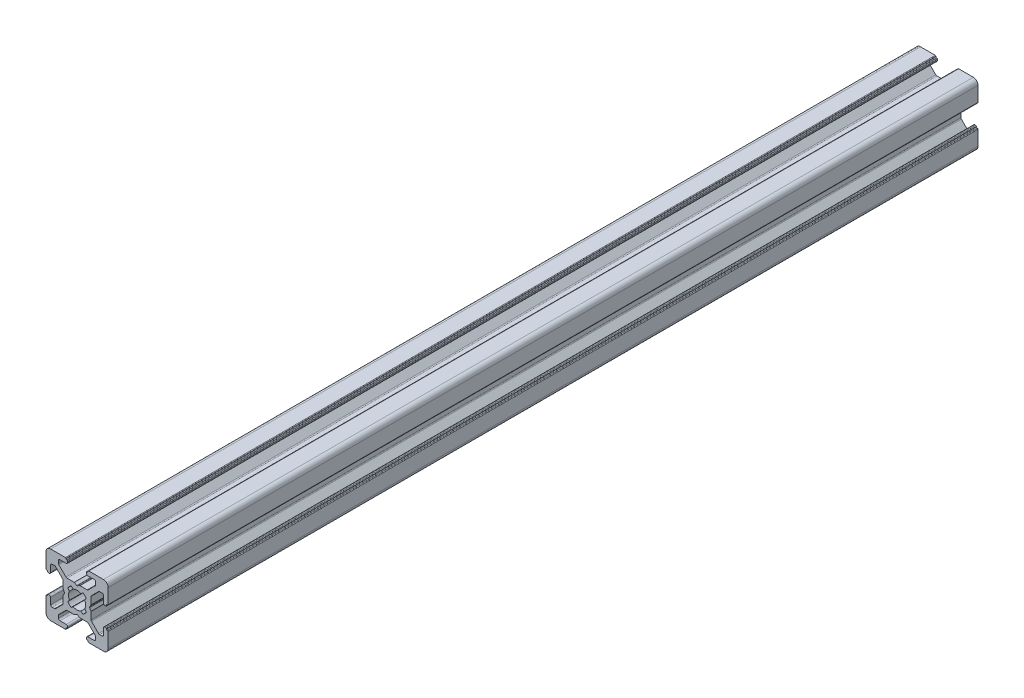
from build123d import *

# Parameters (mm, degrees)
EXTRUDE1_DEPTH = 280


with BuildPart() as part:
    # Sketch1 → Extrude1 (new body)
    with BuildSketch(Plane.XY):
        with BuildLine():
            Line((-3.5, 8.499999673), (-5.500000686, 8.499999673))
            ThreePointArc((-5.500000686, 8.499999673), (-5.853554077, 8.353553064), (-6.000000686, 7.999999673))
            Line((-6.000000686, 7.999999673), (-6.000000686, 7.267766626))
            ThreePointArc((-6.000000686, 7.267766626), (-5.961940448, 7.076424899), (-5.853554059, 6.914213219))
            Line((-5.853554059, 6.914213219), (-3.585787212, 4.646446592))
            ThreePointArc((-3.585787212, 4.646446592), (-3.423575544, 4.538060229), (-3.232233839, 4.5))
            Line((-3.232233839, 4.5), (-0.953590312, 4.5))
            ThreePointArc((-0.953590312, 4.5), (-0.901826505, 4.493185166), (-0.853590316, 4.473205083))
            Line((-0.853590316, 4.473205083), (-0.100000045, 4.038119562))
            ThreePointArc((-0.100000045, 4.038119562), (0, 4.011324632), (0.100000045, 4.038119562))
            Line((0.100000045, 4.038119562), (0.853590316, 4.473205083))
            ThreePointArc((0.853590316, 4.473205083), (0.901826505, 4.493185166), (0.953590312, 4.5))
            Line((0.953590312, 4.5), (3.232233839, 4.5))
            ThreePointArc((3.232233839, 4.5), (3.423575544, 4.538060229), (3.585787212, 4.646446592))
            Line((3.585787212, 4.646446592), (5.853554059, 6.914213219))
            ThreePointArc((5.853554059, 6.914213219), (5.961940448, 7.076424899), (6.000000686, 7.267766626))
            Line((6.000000686, 7.267766626), (6.000000686, 7.999999673))
            ThreePointArc((6.000000686, 7.999999673), (5.853554077, 8.353553064), (5.500000686, 8.499999673))
            Line((5.500000686, 8.499999673), (3.5, 8.499999673))
            ThreePointArc((3.5, 8.499999673), (3.146446609, 8.646446283), (3, 8.999999673))
            Line((3, 8.999999673), (3, 9.3))
            ThreePointArc((3, 9.3), (3.058578644, 9.441421356), (3.2, 9.5))
            Line((3.2, 9.5), (3.350000228, 9.5))
            ThreePointArc((3.350000228, 9.5), (3.491421584, 9.558578644), (3.550000228, 9.7))
            Line((3.550000228, 9.7), (3.550000228, 9.8))
            ThreePointArc((3.550000228, 9.8), (3.608578871, 9.941421356), (3.750000228, 10))
            Line((3.750000228, 10), (8.5, 10))
            ThreePointArc((8.5, 10), (9.560660172, 9.560660172), (10, 8.5))
            Line((10, 8.5), (10, 3.749999605))
            ThreePointArc((10, 3.749999605), (9.941421356, 3.608578248), (9.8, 3.549999605))
            Line((9.8, 3.549999605), (9.699999732, 3.549999605))
            ThreePointArc((9.699999732, 3.549999605), (9.558578376, 3.491420961), (9.499999732, 3.349999605))
            Line((9.499999732, 3.349999605), (9.499999732, 3.2))
            ThreePointArc((9.499999732, 3.2), (9.441421088, 3.058578644), (9.299999732, 3))
            Line((9.299999732, 3), (8.999999732, 3))
            ThreePointArc((8.999999732, 3), (8.646446341, 3.146446609), (8.499999732, 3.5))
            Line((8.499999732, 3.5), (8.499999732, 5.499999605))
            ThreePointArc((8.499999732, 5.499999605), (8.353553123, 5.853552995), (7.999999732, 5.999999605))
            Line((7.999999732, 5.999999605), (7.267766685, 5.999999605))
            ThreePointArc((7.267766685, 5.999999605), (7.076424969, 5.961939371), (6.914213294, 5.853552995))
            Line((6.914213294, 5.853552995), (4.646446398, 3.585786099))
            ThreePointArc((4.646446398, 3.585786099), (4.538060023, 3.423574425), (4.499999789, 3.232232708))
            Line((4.499999789, 3.232232708), (4.499999789, 0.953589302))
            ThreePointArc((4.499999789, 0.953589302), (4.493184953, 0.90182549), (4.473204867, 0.853589297))
            Line((4.473204867, 0.853589297), (4.038119841, 0.099999969))
            ThreePointArc((4.038119841, 0.099999969), (4.011324929, 0), (4.038119841, -0.099999969))
            Line((4.038119841, -0.099999969), (4.473204867, -0.853589297))
            ThreePointArc((4.473204867, -0.853589297), (4.493184953, -0.90182549), (4.499999789, -0.953589302))
            Line((4.499999789, -0.953589302), (4.499999789, -3.232232708))
            ThreePointArc((4.499999789, -3.232232708), (4.538060023, -3.423574425), (4.646446398, -3.585786099))
            Line((4.646446398, -3.585786099), (6.914213294, -5.853552995))
            ThreePointArc((6.914213294, -5.853552995), (7.076424969, -5.961939371), (7.267766685, -5.999999605))
            Line((7.267766685, -5.999999605), (7.999999732, -5.999999605))
            ThreePointArc((7.999999732, -5.999999605), (8.353553123, -5.853552995), (8.499999732, -5.499999605))
            Line((8.499999732, -5.499999605), (8.499999732, -3.5))
            ThreePointArc((8.499999732, -3.5), (8.646446341, -3.146446609), (8.999999732, -3))
            Line((8.999999732, -3), (9.299999732, -3))
            ThreePointArc((9.299999732, -3), (9.441421088, -3.058578644), (9.499999732, -3.2))
            Line((9.499999732, -3.2), (9.499999732, -3.349999605))
            ThreePointArc((9.499999732, -3.349999605), (9.558578376, -3.491420961), (9.699999732, -3.549999605))
            Line((9.699999732, -3.549999605), (9.8, -3.549999605))
            ThreePointArc((9.8, -3.549999605), (9.941421356, -3.608578248), (10, -3.749999605))
            Line((10, -3.749999605), (10, -8.5))
            ThreePointArc((10, -8.5), (9.560660172, -9.560660172), (8.5, -10))
            Line((8.5, -10), (3.750000228, -10))
            ThreePointArc((3.750000228, -10), (3.608578871, -9.941421356), (3.550000228, -9.8))
            Line((3.550000228, -9.8), (3.550000228, -9.7))
            ThreePointArc((3.550000228, -9.7), (3.491421584, -9.558578644), (3.350000228, -9.5))
            Line((3.350000228, -9.5), (3.2, -9.5))
            ThreePointArc((3.2, -9.5), (3.058578644, -9.441421356), (3, -9.3))
            Line((3, -9.3), (3, -8.999999673))
            ThreePointArc((3, -8.999999673), (3.146446609, -8.646446283), (3.5, -8.499999673))
            Line((3.5, -8.499999673), (5.500000686, -8.499999673))
            ThreePointArc((5.500000686, -8.499999673), (5.853554077, -8.353553064), (6.000000686, -7.999999673))
            Line((6.000000686, -7.999999673), (6.000000686, -7.267766626))
            ThreePointArc((6.000000686, -7.267766626), (5.961940448, -7.076424899), (5.853554059, -6.914213219))
            Line((5.853554059, -6.914213219), (3.585787212, -4.646446592))
            ThreePointArc((3.585787212, -4.646446592), (3.423575544, -4.538060229), (3.232233839, -4.5))
            Line((3.232233839, -4.5), (0.953590312, -4.5))
            ThreePointArc((0.953590312, -4.5), (0.901826505, -4.493185166), (0.853590316, -4.473205083))
            Line((0.853590316, -4.473205083), (0.100000045, -4.038119562))
            ThreePointArc((0.100000045, -4.038119562), (0, -4.011324632), (-0.100000045, -4.038119562))
            Line((-0.100000045, -4.038119562), (-0.853590316, -4.473205083))
            ThreePointArc((-0.853590316, -4.473205083), (-0.901826505, -4.493185166), (-0.953590312, -4.5))
            Line((-0.953590312, -4.5), (-3.232233839, -4.5))
            ThreePointArc((-3.232233839, -4.5), (-3.423575544, -4.538060229), (-3.585787212, -4.646446592))
            Line((-3.585787212, -4.646446592), (-5.853554059, -6.914213219))
            ThreePointArc((-5.853554059, -6.914213219), (-5.961940448, -7.076424899), (-6.000000686, -7.267766626))
            Line((-6.000000686, -7.267766626), (-6.000000686, -7.999999673))
            ThreePointArc((-6.000000686, -7.999999673), (-5.853554077, -8.353553064), (-5.500000686, -8.499999673))
            Line((-5.500000686, -8.499999673), (-3.5, -8.499999673))
            ThreePointArc((-3.5, -8.499999673), (-3.146446609, -8.646446283), (-3, -8.999999673))
            Line((-3, -8.999999673), (-3, -9.3))
            ThreePointArc((-3, -9.3), (-3.058578644, -9.441421356), (-3.2, -9.5))
            Line((-3.2, -9.5), (-3.350000228, -9.5))
            ThreePointArc((-3.350000228, -9.5), (-3.491421584, -9.558578644), (-3.550000228, -9.7))
            Line((-3.550000228, -9.7), (-3.550000228, -9.8))
            ThreePointArc((-3.550000228, -9.8), (-3.608578871, -9.941421356), (-3.750000228, -10))
            Line((-3.750000228, -10), (-8.5, -10))
            ThreePointArc((-8.5, -10), (-9.560660172, -9.560660172), (-10, -8.5))
            Line((-10, -8.5), (-10, -3.749999605))
            ThreePointArc((-10, -3.749999605), (-9.941421356, -3.608578248), (-9.8, -3.549999605))
            Line((-9.8, -3.549999605), (-9.699999732, -3.549999605))
            ThreePointArc((-9.699999732, -3.549999605), (-9.558578376, -3.491420961), (-9.499999732, -3.349999605))
            Line((-9.499999732, -3.349999605), (-9.499999732, -3.2))
            ThreePointArc((-9.499999732, -3.2), (-9.441421088, -3.058578644), (-9.299999732, -3))
            Line((-9.299999732, -3), (-8.999999732, -3))
            ThreePointArc((-8.999999732, -3), (-8.646446341, -3.146446609), (-8.499999732, -3.5))
            Line((-8.499999732, -3.5), (-8.499999732, -5.499999605))
            ThreePointArc((-8.499999732, -5.499999605), (-8.353553123, -5.853552995), (-7.999999732, -5.999999605))
            Line((-7.999999732, -5.999999605), (-7.267766685, -5.999999605))
            ThreePointArc((-7.267766685, -5.999999605), (-7.076424969, -5.961939371), (-6.914213294, -5.853552995))
            Line((-6.914213294, -5.853552995), (-4.646446398, -3.585786099))
            ThreePointArc((-4.646446398, -3.585786099), (-4.538060023, -3.423574425), (-4.499999789, -3.232232708))
            Line((-4.499999789, -3.232232708), (-4.499999789, -0.953589302))
            ThreePointArc((-4.499999789, -0.953589302), (-4.493184953, -0.90182549), (-4.473204867, -0.853589297))
            Line((-4.473204867, -0.853589297), (-4.038119841, -0.099999969))
            ThreePointArc((-4.038119841, -0.099999969), (-4.011324929, 0), (-4.038119841, 0.099999969))
            Line((-4.038119841, 0.099999969), (-4.473204867, 0.853589297))
            ThreePointArc((-4.473204867, 0.853589297), (-4.493184953, 0.90182549), (-4.499999789, 0.953589302))
            Line((-4.499999789, 0.953589302), (-4.499999789, 3.232232708))
            ThreePointArc((-4.499999789, 3.232232708), (-4.538060023, 3.423574425), (-4.646446398, 3.585786099))
            Line((-4.646446398, 3.585786099), (-6.914213294, 5.853552995))
            ThreePointArc((-6.914213294, 5.853552995), (-7.076424969, 5.961939371), (-7.267766685, 5.999999605))
            Line((-7.267766685, 5.999999605), (-7.999999732, 5.999999605))
            ThreePointArc((-7.999999732, 5.999999605), (-8.353553123, 5.853552995), (-8.499999732, 5.499999605))
            Line((-8.499999732, 5.499999605), (-8.499999732, 3.5))
            ThreePointArc((-8.499999732, 3.5), (-8.646446341, 3.146446609), (-8.999999732, 3))
            Line((-8.999999732, 3), (-9.299999732, 3))
            ThreePointArc((-9.299999732, 3), (-9.441421088, 3.058578644), (-9.499999732, 3.2))
            Line((-9.499999732, 3.2), (-9.499999732, 3.349999605))
            ThreePointArc((-9.499999732, 3.349999605), (-9.558578376, 3.491420961), (-9.699999732, 3.549999605))
            Line((-9.699999732, 3.549999605), (-9.8, 3.549999605))
            ThreePointArc((-9.8, 3.549999605), (-9.941421356, 3.608578248), (-10, 3.749999605))
            Line((-10, 3.749999605), (-10, 8.5))
            ThreePointArc((-10, 8.5), (-9.560660172, 9.560660172), (-8.5, 10))
            Line((-8.5, 10), (-3.750000228, 10))
            ThreePointArc((-3.750000228, 10), (-3.608578871, 9.941421356), (-3.550000228, 9.8))
            Line((-3.550000228, 9.8), (-3.550000228, 9.7))
            ThreePointArc((-3.550000228, 9.7), (-3.491421584, 9.558578644), (-3.350000228, 9.5))
            Line((-3.350000228, 9.5), (-3.2, 9.5))
            ThreePointArc((-3.2, 9.5), (-3.058578644, 9.441421356), (-3, 9.3))
            Line((-3, 9.3), (-3, 8.999999673))
            ThreePointArc((-3, 8.999999673), (-3.146446609, 8.646446283), (-3.5, 8.499999673))
        make_face()
        with BuildLine():
            Line((-1.258185436, 2.445295362), (-1.91389502, 2.989640962))
            ThreePointArc((-1.91389502, 2.989640962), (-2.511737261, 2.508410485), (-2.992174953, 1.909930962))
            Line((-2.992174953, 1.909930962), (-2.445295423, 1.258185317))
            ThreePointArc((-2.445295423, 1.258185317), (-2.75, 0), (-2.445295423, -1.258185317))
            Line((-2.445295423, -1.258185317), (-2.992174953, -1.909930962))
            ThreePointArc((-2.992174953, -1.909930962), (-2.511737261, -2.508410485), (-1.91389502, -2.989640962))
            Line((-1.91389502, -2.989640962), (-1.258185436, -2.445295362))
            ThreePointArc((-1.258185436, -2.445295362), (0, -2.75), (1.258185436, -2.445295362))
            Line((1.258185436, -2.445295362), (1.91389502, -2.989640962))
            ThreePointArc((1.91389502, -2.989640962), (2.511737261, -2.508410485), (2.992174953, -1.909930962))
            Line((2.992174953, -1.909930962), (2.445295423, -1.258185317))
            ThreePointArc((2.445295423, -1.258185317), (2.75, 0), (2.445295423, 1.258185317))
            Line((2.445295423, 1.258185317), (2.992174953, 1.909930962))
            ThreePointArc((2.992174953, 1.909930962), (2.511737261, 2.508410485), (1.91389502, 2.989640962))
            Line((1.91389502, 2.989640962), (1.258185436, 2.445295362))
            ThreePointArc((1.258185436, 2.445295362), (0, 2.75), (-1.258185436, 2.445295362))
        make_face(mode=Mode.SUBTRACT)
    extrude(amount=EXTRUDE1_DEPTH)


solid = part.part
